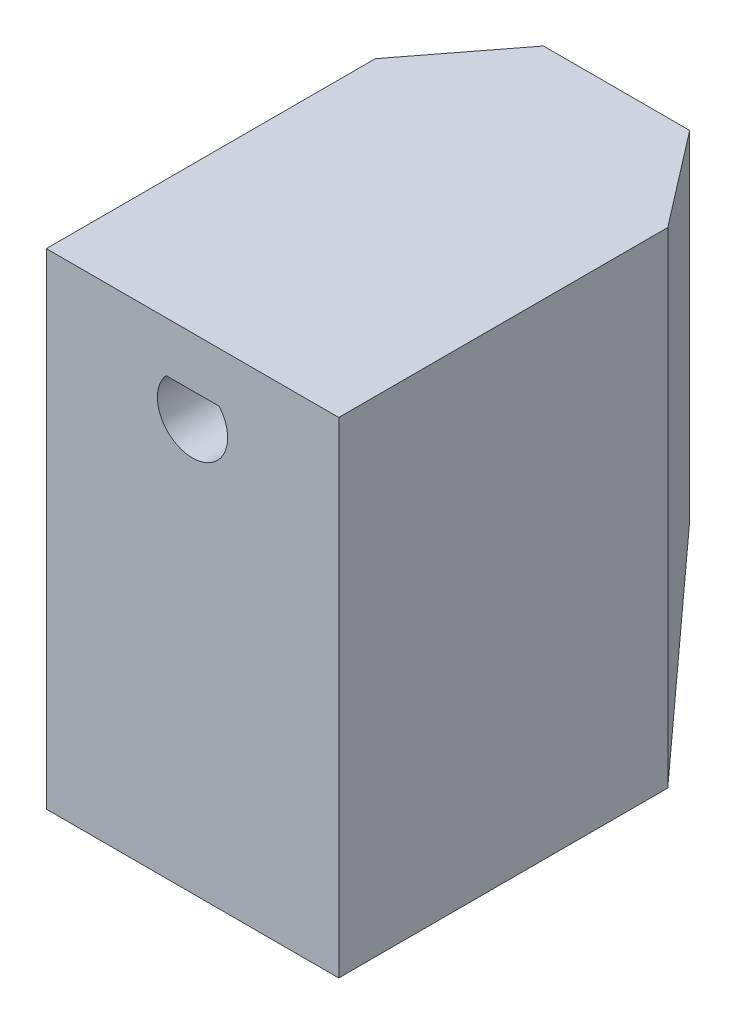
from build123d import *

# Parameters (mm, degrees)
BOSS_EXTRUDE1_DEPTH = 25.4
CUT_EXTRUDE1_DEPTH  = 9.5
SKETCH5_W           = 25.4
SKETCH5_H           = 42.164
BOSS_EXTRUDE2_DEPTH = 11.43
CUT_EXTRUDE2_REACH  = 53.538
CUT_EXTRUDE3_REACH  = 53.255
CUT_EXTRUDE4_DEPTH  = 20
SKETCH10_W          = 19.05
SKETCH10_H          = 19.05
CUT_EXTRUDE5_DEPTH  = 26.289
CUT_EXTRUDE6_REACH  = 55.322
SKETCH11_W          = 1.5875
SKETCH11_H          = 12.7


with BuildPart() as part:
    # Sketch2 → Boss-Extrude1 (new body)
    with BuildSketch(Plane.XY):
        Polygon((12.7, -6.35), (14.2875, -6.35), (14.2875, 6.35), (-14.2875, 6.35), (-14.2875, -6.35), (-12.7, -6.35), (-12.7, -35.814), (12.7, -35.814), align=None)
    extrude(amount=BOSS_EXTRUDE1_DEPTH)

    # Sketch3 → Cut-Extrude1 (cut)
    with BuildSketch(Plane.XY.offset(25.4)):
        with BuildLine():
            Line((-2.3, 2.003122562), (2.3, 2.003122562))
            ThreePointArc((2.3, 2.003122562), (0, -3.05), (-2.3, 2.003122562))
        make_face()
    extrude(amount=-CUT_EXTRUDE1_DEPTH, mode=Mode.SUBTRACT)

    # Sketch5 → Boss-Extrude2 (add)
    with BuildSketch(Plane(origin=(0, 0, 0), x_dir=(-1, 0, 0), z_dir=(0, 0, -1))):
        with Locations((0, -14.732)):
            Rectangle(SKETCH5_W, SKETCH5_H)
    extrude(amount=BOSS_EXTRUDE2_DEPTH)

    # Sketch6 → Cut-Extrude2 (cut, up to next)
    with BuildSketch(Plane(origin=(12.7, 0, 0), x_dir=(0, 0, -1), z_dir=(1, 0, 0)), mode=Mode.PRIVATE) as cut_extrude2_sk1:
        Polygon((3.175, -35.814), (11.43, -23.01875), (11.43, -35.814), align=None)
    cut_extrude2_tool1 = extrude(cut_extrude2_sk1.sketch, amount=-CUT_EXTRUDE2_REACH, mode=Mode.PRIVATE) & part.part
    add(cut_extrude2_tool1.solids().sort_by_distance((12.7, -31.548917, -8.678333))[0], mode=Mode.SUBTRACT)

    # Sketch7 → Cut-Extrude3 (cut, up to next)
    with BuildSketch(Plane.XZ.offset(35.814), mode=Mode.PRIVATE) as cut_extrude3_sk1:
        Polygon((-12.7, -11.43), (-12.7, -3.175), (-6.35, -11.43), align=None)
    cut_extrude3_tool1 = extrude(cut_extrude3_sk1.sketch, amount=-CUT_EXTRUDE3_REACH, mode=Mode.PRIVATE) & part.part
    # Sketch7 → Cut-Extrude3 (cut, up to next)
    with BuildSketch(Plane.XZ.offset(35.814), mode=Mode.PRIVATE) as cut_extrude3_sk2:
        Polygon((6.35, -11.43), (12.7, -3.175), (12.7, -11.43), align=None)
    cut_extrude3_tool2 = extrude(cut_extrude3_sk2.sketch, amount=-CUT_EXTRUDE3_REACH, mode=Mode.PRIVATE) & part.part
    add(cut_extrude3_tool1.solids().sort_by_distance((-10.583333, -35.814, -8.678333))[0], mode=Mode.SUBTRACT)
    add(cut_extrude3_tool2.solids().sort_by_distance((10.583333, -35.814, -8.678333))[0], mode=Mode.SUBTRACT)

    # Sketch8 → Cut-Extrude4 (cut)
    with BuildSketch(Plane(origin=(0, 0, -11.43), x_dir=(-1, 0, 0), z_dir=(0, 0, -1))):
        with BuildLine():
            Line((-1.651, 2.859615883), (1.651, 2.859615883))
            ThreePointArc((1.651, 2.859615883), (0, -3.302), (-1.651, 2.859615883))
        make_face()
    extrude(amount=-CUT_EXTRUDE4_DEPTH, mode=Mode.SUBTRACT)

    # Sketch10 → Cut-Extrude5 (cut)
    with BuildSketch(Plane.XZ.offset(35.814)):
        with Locations((0, 12.7)):
            Rectangle(SKETCH10_W, SKETCH10_H)
    extrude(amount=-CUT_EXTRUDE5_DEPTH, mode=Mode.SUBTRACT)

    # Sketch11 → Cut-Extrude6 (cut, up to next)
    with BuildSketch(Plane.XY.offset(25.4), mode=Mode.PRIVATE) as cut_extrude6_sk1:
        with Locations((-13.49375, 0)):
            Rectangle(SKETCH11_W, SKETCH11_H)
    cut_extrude6_tool1 = extrude(cut_extrude6_sk1.sketch, amount=-CUT_EXTRUDE6_REACH, mode=Mode.PRIVATE) & part.part
    # Sketch11 → Cut-Extrude6 (cut, up to next)
    with BuildSketch(Plane.XY.offset(25.4), mode=Mode.PRIVATE) as cut_extrude6_sk2:
        with Locations((13.49375, 0)):
            Rectangle(SKETCH11_W, SKETCH11_H)
    cut_extrude6_tool2 = extrude(cut_extrude6_sk2.sketch, amount=-CUT_EXTRUDE6_REACH, mode=Mode.PRIVATE) & part.part
    add(cut_extrude6_tool1.solids().sort_by_distance((-13.49375, 0, 25.4))[0], mode=Mode.SUBTRACT)
    add(cut_extrude6_tool2.solids().sort_by_distance((13.49375, 0, 25.4))[0], mode=Mode.SUBTRACT)


solid = part.part
